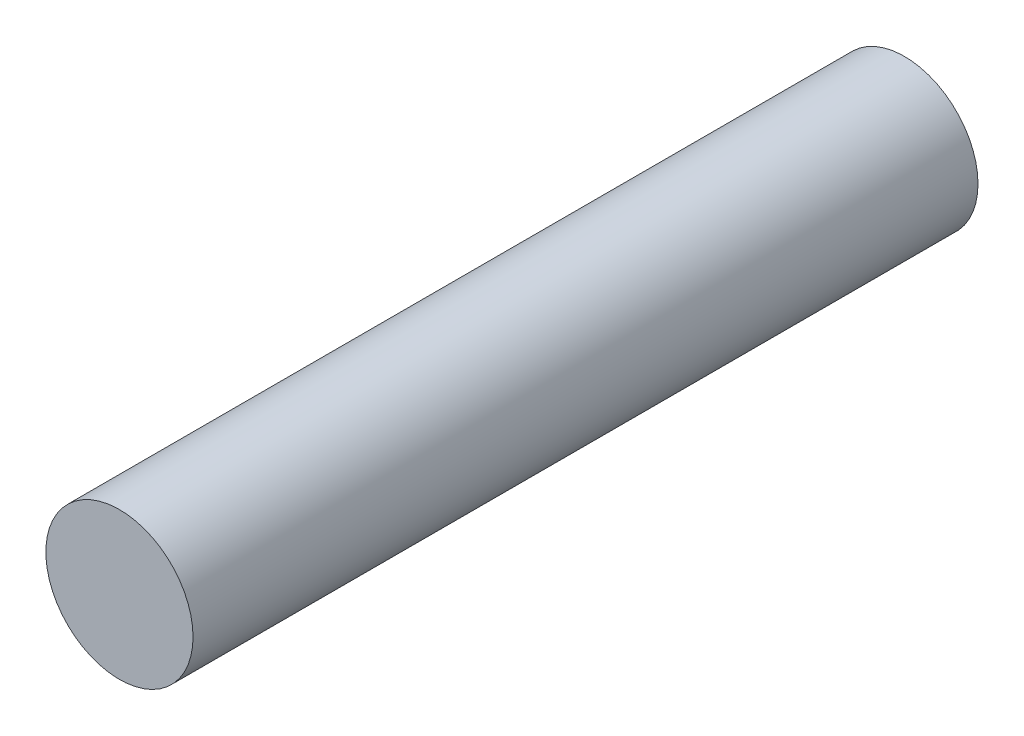
from build123d import *

# Parameters (mm, degrees)
BOSS_EXTRUDE1_DEPTH      = 40
BOSS_EXTRUDE1_DEPTH_BACK = 40
SKETCH1_R                = 7.5


with BuildPart() as part:
    # Sketch1 → Boss-Extrude1 (new, two sides: drawn at the far end of the back side and taken through both)
    with BuildSketch(Plane.XY.offset(-BOSS_EXTRUDE1_DEPTH_BACK)):
        Circle(SKETCH1_R)
    extrude(amount=BOSS_EXTRUDE1_DEPTH + BOSS_EXTRUDE1_DEPTH_BACK)


solid = part.part
